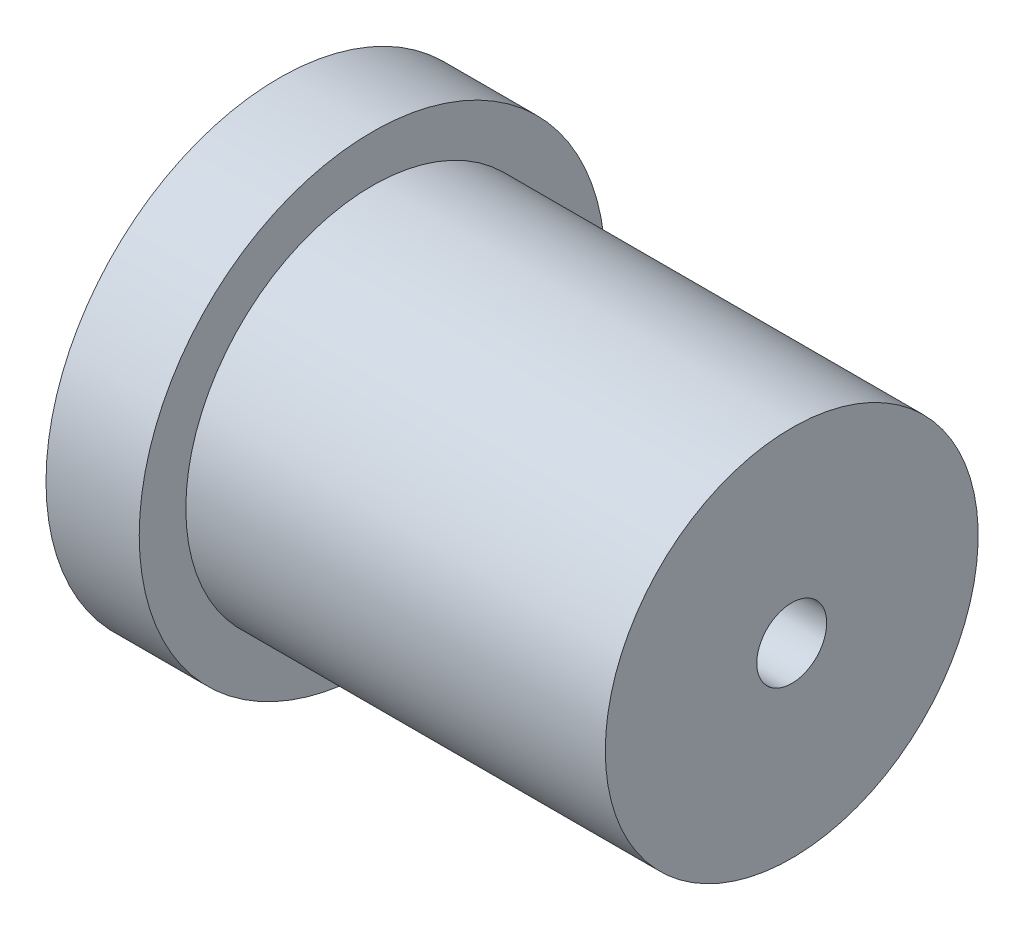
from build123d import *


with BuildPart() as part:
    # Sketch1 → Revolve1 (revolve)
    with BuildSketch(Plane.XY, mode=Mode.PRIVATE) as revolve1_sk:
        Polygon((-2.75, 2.5), (-1.75, 2.5), (-1.75, 2), (2.75, 2), (2.75, 0.375), (-2.75, 0.375), align=None)
    revolve(revolve1_sk.sketch.rotate(Axis((-2.75, 0, 0), (1, 0, 0)), 90), axis=Axis((-2.75, 0, 0), (1, 0, 0)))


solid = part.part
